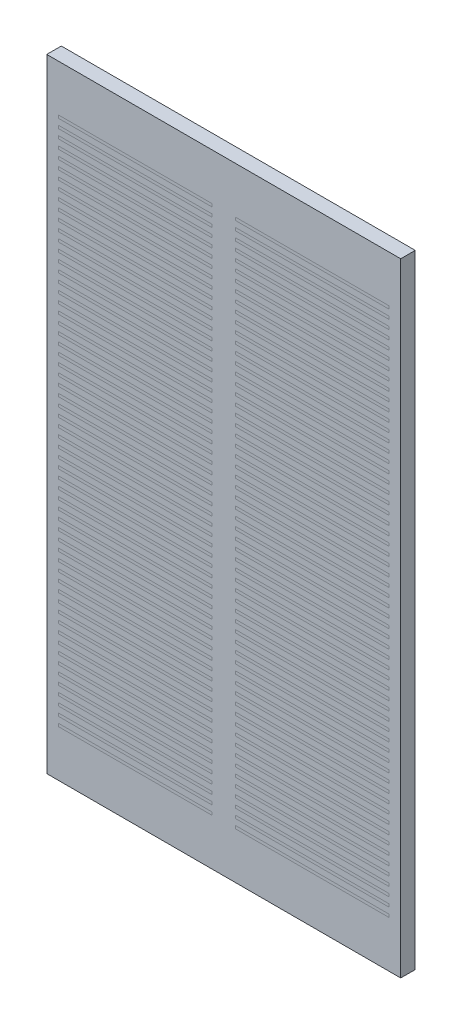
from build123d import *

# Parameters (mm, degrees)
CROQUIS1_W              = 60.8
CROQUIS1_H              = 107
SALIENTE_EXTRUIR1_DEPTH = 2.5


with BuildPart() as part:
    # Croquis1 → Saliente-Extruir1 (new body)
    with BuildSketch(Plane.XY):
        Rectangle(CROQUIS1_W, CROQUIS1_H)
    extrude(amount=SALIENTE_EXTRUIR1_DEPTH)


solid = part.part
